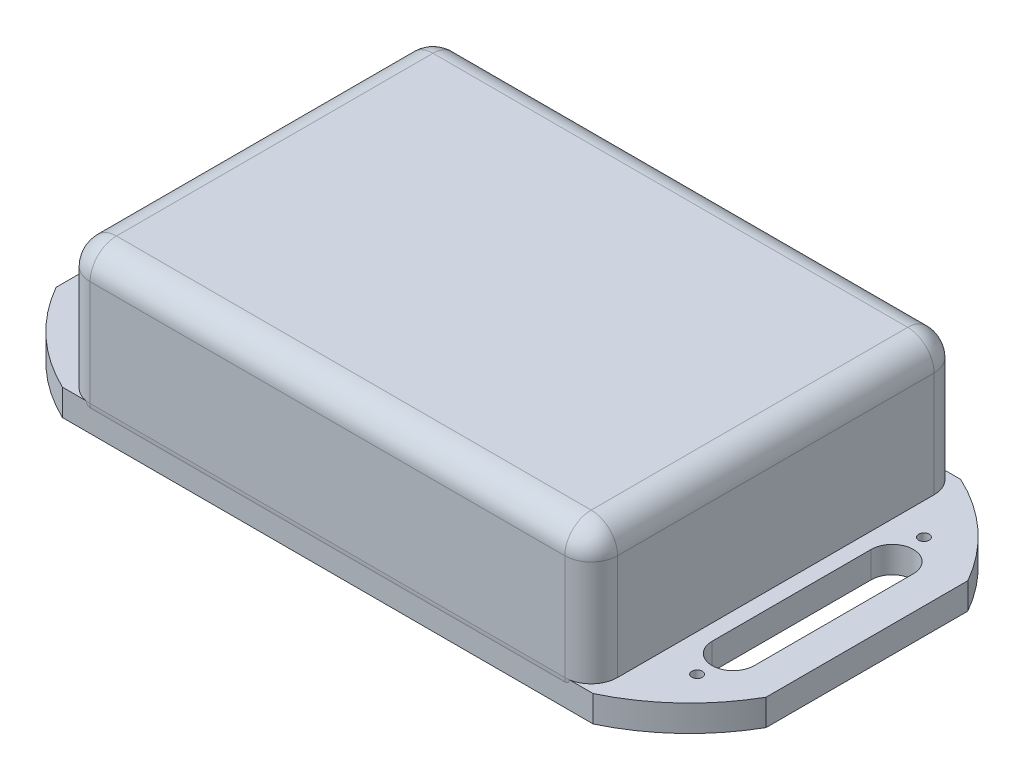
from build123d import *

# Parameters (mm, degrees)
BOSS_EXTRUDE2_DEPTH = 15
FILLET2_R           = 2.5
SKETCH3_R           = 0.5
BOSS_EXTRUDE4_DEPTH = 2.5


with BuildPart() as part:
    # Sketch1 → Boss-Extrude2 (new body)
    with BuildSketch(Plane(origin=(0, 0, 0), x_dir=(1, 0, 0), z_dir=(0, 1, 0))):
        with BuildLine():
            Line((-23.383883476, 16.616116524), (21.616116524, 16.616116524))
            ThreePointArc((21.616116524, 16.616116524), (23.383883476, 15.883883476), (24.116116524, 14.116116524))
            Line((24.116116524, 14.116116524), (24.116116524, -15.883883476))
            ThreePointArc((24.116116524, -15.883883476), (23.383883476, -17.651650429), (21.616116524, -18.383883476))
            Line((21.616116524, -18.383883476), (-23.383883476, -18.383883476))
            ThreePointArc((-23.383883476, -18.383883476), (-25.151650429, -17.651650429), (-25.883883476, -15.883883476))
            Line((-25.883883476, -15.883883476), (-25.883883476, 14.116116524))
            ThreePointArc((-25.883883476, 14.116116524), (-25.151650429, 15.883883476), (-23.383883476, 16.616116524))
        make_face()
    extrude(amount=BOSS_EXTRUDE2_DEPTH)

    # Fillet2
    fillet2_edges = [part.edges().sort_by_distance(p)[0] for p in [
        (-25.151650429, 15, 17.651650429),
        (-25.883883476, 0, 0.883883476),
        (-25.151650429, 0, -15.883883476),
        (-0.883883476, 15, 18.383883476),
        (23.383883476, 15, 17.651650429),
        (24.116116524, 15, 0.883883476),
        (23.383883476, 15, -15.883883476),
        (-0.883883476, 15, -16.616116524),
        (-25.151650429, 15, -15.883883476),
        (-25.883883476, 15, 0.883883476),
        (-0.883883476, 0, -16.616116524),
        (23.383883476, 0, -15.883883476),
        (24.116116524, 0, 0.883883476),
        (23.383883476, 0, 17.651650429),
        (-0.883883476, 0, 18.383883476),
        (-25.151650429, 0, 17.651650429),
    ]]
    fillet(fillet2_edges, radius=FILLET2_R)

    # Sketch3 → Boss-Extrude4 (add)
    with BuildSketch(Plane(origin=(0, 0, 0), x_dir=(1, 0, 0), z_dir=(0, 1, 0))):
        with BuildLine():
            Line((-25.883883476, 16.646945133), (24.116116524, 16.646945133))
            ThreePointArc((24.116116524, 16.646945133), (29.061870418, 13.334132498), (32.766116524, 8.674328862))
            Line((32.766116524, 8.674328862), (32.766116524, -10.453501419))
            ThreePointArc((32.766116524, -10.453501419), (29.124788001, -15.055056138), (24.271254893, -18.353054867))
            Line((24.271254893, -18.353054867), (-26.039021846, -18.353054867))
            ThreePointArc((-26.039021846, -18.353054867), (-30.892554954, -15.055056138), (-34.533883476, -10.453501419))
            Line((-34.533883476, -10.453501419), (-34.533883476, 8.674328862))
            ThreePointArc((-34.533883476, 8.674328862), (-30.829637371, 13.334132498), (-25.883883476, 16.646945133))
        make_face()
        with Locations(Location((-28.883883476, 10.158483361, 0), (0, 0, 270))):
            Circle(SKETCH3_R, mode=Mode.SUBTRACT)
        with Locations(Location((-29.383883476, -11.841516639, 0), (0, 0, 270))):
            Circle(SKETCH3_R, mode=Mode.SUBTRACT)
        with Locations(Location((27.616116524, -11.841516639, 0), (0, 0, 270))):
            Circle(SKETCH3_R, mode=Mode.SUBTRACT)
        with Locations(Location((27.116116524, 10.158483361, 0), (0, 0, 270))):
            Circle(SKETCH3_R, mode=Mode.SUBTRACT)
        with BuildLine():
            Line((29.616116524, 6.658483361), (29.616116524, -8.426250314))
            ThreePointArc((29.616116524, -8.426250314), (27.616116524, -10.426250314), (25.616116524, -8.426250314))
            Line((25.616116524, -8.426250314), (25.616116524, 6.658483361))
            ThreePointArc((25.616116524, 6.658483361), (27.616116524, 8.658483361), (29.616116524, 6.658483361))
        make_face(mode=Mode.SUBTRACT)
        with BuildLine():
            Line((-31.383883476, 6.658483361), (-31.383883476, -8.426250314))
            ThreePointArc((-31.383883476, -8.426250314), (-29.383883476, -10.426250314), (-27.383883476, -8.426250314))
            Line((-27.383883476, -8.426250314), (-27.383883476, 6.658483361))
            ThreePointArc((-27.383883476, 6.658483361), (-29.383883476, 8.658483361), (-31.383883476, 6.658483361))
        make_face(mode=Mode.SUBTRACT)
    extrude(amount=BOSS_EXTRUDE4_DEPTH)


solid = part.part
